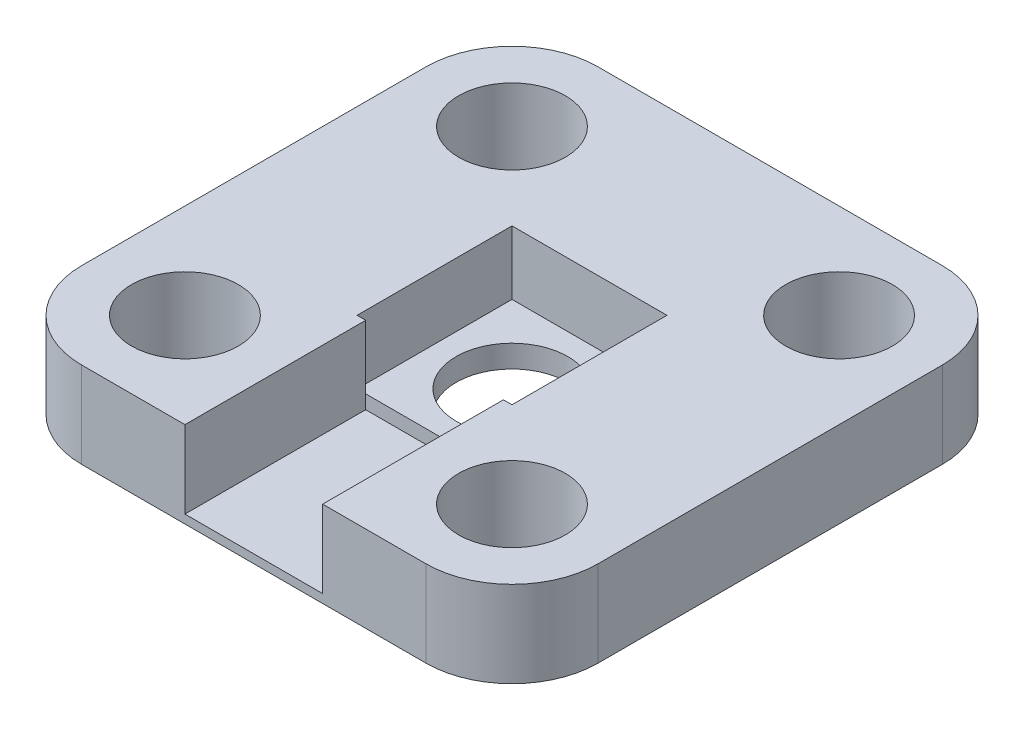
from build123d import *

# Parameters (mm, degrees)
BASE_R              = 1.55
BOSS_EXTRUDE1_DEPTH = 2.5
SKETCH1_3_R         = 1.625
BOSS_EXTRUDE2_DEPTH = 0.65
SKETCH1_4_W         = 4
SKETCH1_4_H         = 5.25
BOSS_EXTRUDE3_DEPTH = 0.25
FILLET1_R           = 2.5


with BuildPart() as part:
    # Base → Boss-Extrude1 (new body)
    with BuildSketch(Plane(origin=(0, 0, 0), x_dir=(1, 0, 0), z_dir=(0, 1, 0))):
        Polygon((-7.5, -7.5), (-2, -7.5), (-2, -2.25), (-2.25, -2.25), (-2.25, 2.25), (2.25, 2.25), (2.25, -2.25), (2, -2.25), (2, -7.5), (7.5, -7.5), (7.5, 7.5), (-7.5, 7.5), align=None)
        with Locations((-4.75, -4.75)):
            Circle(BASE_R, mode=Mode.SUBTRACT)
        with Locations((4.75, -4.75)):
            Circle(BASE_R, mode=Mode.SUBTRACT)
        with Locations((-4.75, 4.75)):
            Circle(BASE_R, mode=Mode.SUBTRACT)
        with Locations((4.75, 4.75)):
            Circle(BASE_R, mode=Mode.SUBTRACT)
    extrude(amount=BOSS_EXTRUDE1_DEPTH)

    # Sketch1<3> → Boss-Extrude2 (add)
    with BuildSketch(Plane(origin=(0, 0, 0), x_dir=(1, 0, 0), z_dir=(0, 1, 0))):
        Polygon((-2.25, -2.25), (-2, -2.25), (2, -2.25), (2.25, -2.25), (2.25, 2.25), (-2.25, 2.25), align=None)
        Circle(SKETCH1_3_R, mode=Mode.SUBTRACT)
    extrude(amount=BOSS_EXTRUDE2_DEPTH)

    # Sketch1<4> → Boss-Extrude3 (add)
    with BuildSketch(Plane(origin=(0, 0, 0), x_dir=(1, 0, 0), z_dir=(0, 1, 0))):
        with Locations((0, -4.875)):
            Rectangle(SKETCH1_4_W, SKETCH1_4_H)
    extrude(amount=BOSS_EXTRUDE3_DEPTH)

    # Fillet1
    fillet1_edges = [part.edges().sort_by_distance(p)[0] for p in [
        (-7.5, 1.25, 7.5),
        (-7.5, 1.25, -7.5),
        (7.5, 1.25, -7.5),
        (7.5, 1.25, 7.5),
    ]]
    fillet(fillet1_edges, radius=FILLET1_R)


solid = part.part
